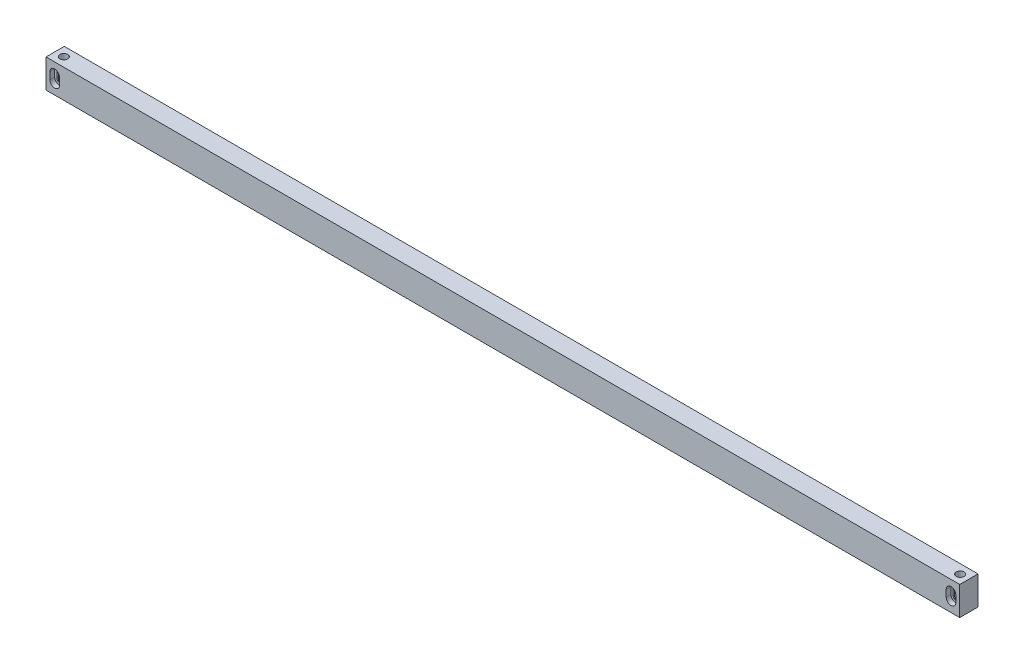
from build123d import *

# Parameters (mm, degrees)
SKETCH1_W                = 1050
SKETCH1_H                = 33
BOSS_EXTRUDE1_DEPTH      = 10.5
CUT_EXTRUDE1_START       = 26
CUT_EXTRUDE1_DEPTH       = 21
F_9_0_9_DIAMETER_HOLE1_D = 9


with BuildPart() as part:
    # Sketch1 → Boss-Extrude1 (new, symmetric)
    with BuildSketch(Plane.XY):
        with Locations((505, 16.5)):
            Rectangle(SKETCH1_W, SKETCH1_H)
        with BuildLine():
            Line((-7, 20.5), (-7, 12.5))
            ThreePointArc((-7, 12.5), (-10, 9.5), (-13, 12.5))
            Line((-13, 12.5), (-13, 20.5))
            ThreePointArc((-13, 20.5), (-10, 23.5), (-7, 20.5))
        make_face(mode=Mode.SUBTRACT)
        with BuildLine():
            ThreePointArc((1017, 20.5), (1020, 23.5), (1023, 20.5))
            Line((1023, 20.5), (1023, 12.5))
            ThreePointArc((1023, 12.5), (1020, 9.5), (1017, 12.5))
            Line((1017, 12.5), (1017, 20.5))
        make_face(mode=Mode.SUBTRACT)
    extrude(amount=BOSS_EXTRUDE1_DEPTH, both=True)

    # Sketch1<3> → Cut-Extrude1 (cut)
    # profile 1 of 2: a face of its own
    with BuildSketch(Plane.XY.offset(CUT_EXTRUDE1_START)):
        with BuildLine():
            Line((-4.5, 12.5), (-4.5, 20.5))
            ThreePointArc((-4.5, 20.5), (-10, 26), (-15.5, 20.5))
            Line((-15.5, 20.5), (-15.5, 12.5))
            ThreePointArc((-15.5, 12.5), (-10, 7), (-4.5, 12.5))
        make_face()
        with BuildLine():
            ThreePointArc((-13, 20.5), (-10, 23.5), (-7, 20.5))
            Line((-7, 20.5), (-7, 12.5))
            ThreePointArc((-7, 12.5), (-10, 9.5), (-13, 12.5))
            Line((-13, 12.5), (-13, 20.5))
        make_face(mode=Mode.SUBTRACT)
    # profile 2 of 2: a face of its own
    with BuildSketch(Plane.XY.offset(CUT_EXTRUDE1_START)):
        with BuildLine():
            Line((1025.5, 12.5), (1025.5, 20.5))
            ThreePointArc((1025.5, 20.5), (1020, 26), (1014.5, 20.5))
            Line((1014.5, 20.5), (1014.5, 12.5))
            ThreePointArc((1014.5, 12.5), (1020, 7), (1025.5, 12.5))
        make_face()
        with BuildLine():
            Line((1017, 12.5), (1017, 20.5))
            ThreePointArc((1017, 20.5), (1020, 23.5), (1023, 20.5))
            Line((1023, 20.5), (1023, 12.5))
            ThreePointArc((1023, 12.5), (1020, 9.5), (1017, 12.5))
        make_face(mode=Mode.SUBTRACT)
    cut_extrude1 = extrude(amount=-CUT_EXTRUDE1_DEPTH, mode=Mode.SUBTRACT)

    # Mirror1: Cut-Extrude1 across plane
    add(cut_extrude1.mirror(Plane.XY), mode=Mode.SUBTRACT)

    # Ø9.0 (9) Diameter Hole1 (through all)
    with Locations(Plane(origin=(0, 33, 0), x_dir=(1, 0, 0), z_dir=(0, 1, 0))):
        with Locations((-10, 0), (1020, 0)):
            Hole(F_9_0_9_DIAMETER_HOLE1_D / 2)


solid = part.part
